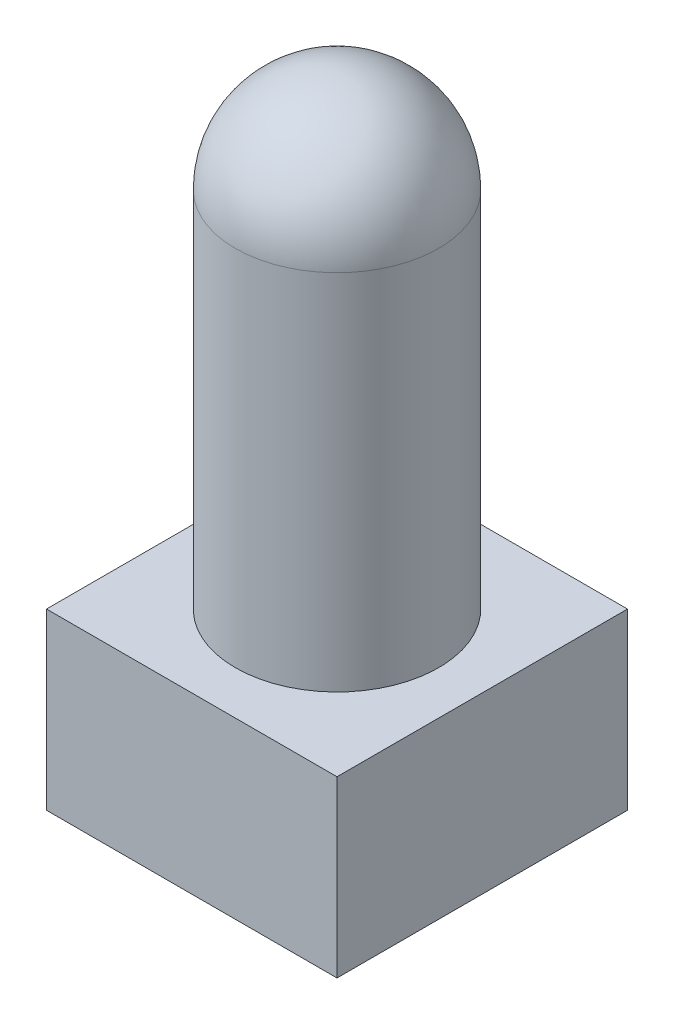
from build123d import *

# Parameters (mm, degrees)
SKETCH1_R           = 1.75
BOSS_EXTRUDE1_DEPTH = 11
FILLET1_R           = 1.75
SKETCH3_W           = 5
SKETCH3_H           = 5
BOSS_EXTRUDE2_DEPTH = 3


with BuildPart() as part:
    # Sketch1 → Boss-Extrude1 (new body)
    with BuildSketch(Plane(origin=(0, 0, 0), x_dir=(1, 0, 0), z_dir=(0, 1, 0))):
        with Locations(Location((0, 0, 0), (0, 0, 270))):
            Circle(SKETCH1_R)
    extrude(amount=BOSS_EXTRUDE1_DEPTH)

    # Fillet1
    fillet1_edges = [part.edges().sort_by_distance(p)[0] for p in [
        (0, 11, -1.75),
    ]]
    fillet(fillet1_edges, radius=FILLET1_R)

    # Sketch3 → Boss-Extrude2 (add)
    with BuildSketch(Plane.XZ):
        Rectangle(SKETCH3_W, SKETCH3_H)
    extrude(amount=-BOSS_EXTRUDE2_DEPTH)


solid = part.part
